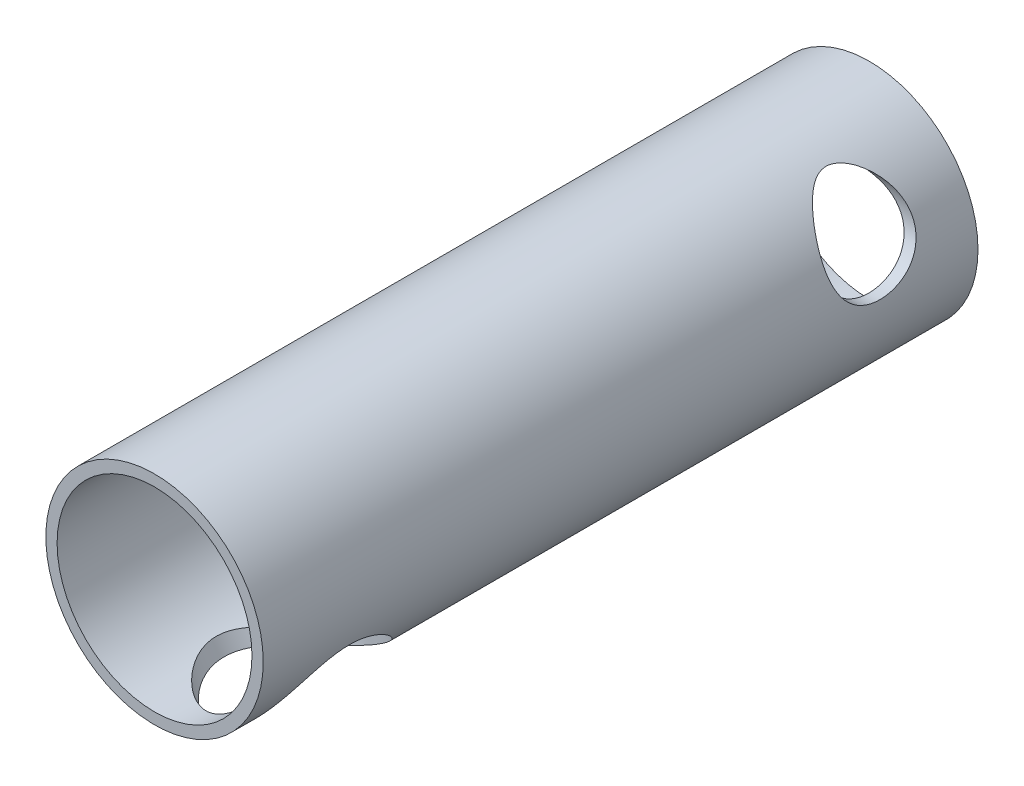
from build123d import *

# Parameters (mm, degrees)
SKETCH1_R               = 22.21
SKETCH1_R_2             = 19.91
BOSS_EXTRUDE1_DEPTH     = 146.05
CUT_EXTRUDE2_REACH      = 157.431
CUT_EXTRUDE2_END_RADIUS = 19.91
SKETCH5_R               = 14.8463
CUT_EXTRUDE3_REACH      = 156.263
SKETCH4_R               = 9.0424


with BuildPart() as part:
    # Sketch1 → Boss-Extrude1 (new body)
    with BuildSketch(Plane.XY):
        with Locations((-0.049436733, 0)):
            Circle(SKETCH1_R)
        with Locations((-0.049436733, 0)):
            Circle(SKETCH1_R_2, mode=Mode.SUBTRACT)
    extrude(amount=BOSS_EXTRUDE1_DEPTH)

    # Cut-Extrude2: up to this cylinder (the profile starts outside it)
    cut_extrude2_end = Plane(origin=(-0.049436733, 0, 127.35), z_dir=(0, 0, -1)) * Cylinder(CUT_EXTRUDE2_END_RADIUS, 355.682, mode=Mode.PRIVATE)
    # Sketch5 → Cut-Extrude2 (cut, up to the surface)
    with BuildSketch(Plane(origin=(11.092620184, -19.212981748, 146.05), x_dir=(-0.8650599616540103, -0.5016684789212517, 0), z_dir=(0.5016684789212515, -0.8650599616540102, 0)), mode=Mode.PRIVATE) as cut_extrude2_sk1:
        with Locations(Location((-0.049436639, 18.7, 0), (0, 0, 180))):
            Circle(SKETCH5_R)
    cut_extrude2_tool1 = extrude(cut_extrude2_sk1.sketch, amount=-CUT_EXTRUDE2_REACH, mode=Mode.PRIVATE) - cut_extrude2_end
    add(cut_extrude2_tool1.solids().sort_by_distance((11.135386, -19.188181, 127.35))[0], mode=Mode.SUBTRACT)

    # Sketch4 → Cut-Extrude3 (cut, up to next)
    with BuildSketch(Plane(origin=(22.160563267, 0, 146.05), x_dir=(0, 0, -1), z_dir=(1, 0, 0)), mode=Mode.PRIVATE) as cut_extrude3_sk1:
        with Locations(Location((126.05, 10.153466667, 0), (0, 0, 90))):
            Circle(SKETCH4_R)
    cut_extrude3_tool1 = extrude(cut_extrude3_sk1.sketch, amount=-CUT_EXTRUDE3_REACH, mode=Mode.PRIVATE) & part.part
    add(cut_extrude3_tool1.solids().sort_by_distance((22.160563, 10.153467, 20))[0], mode=Mode.SUBTRACT)


solid = part.part
